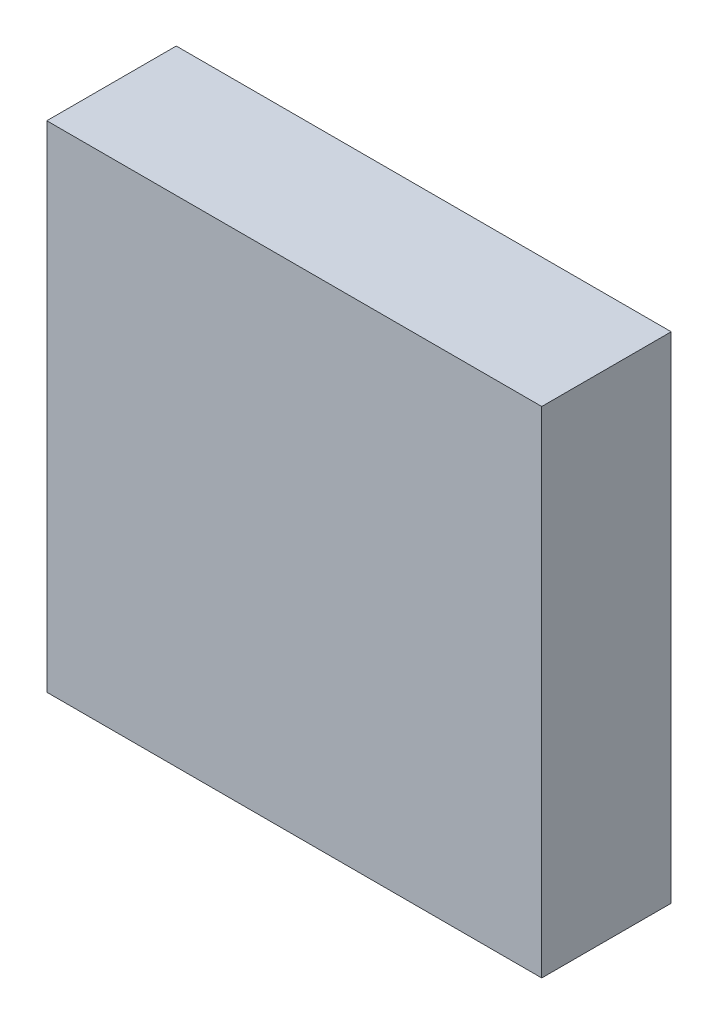
from build123d import *

# Parameters (mm, degrees)
SKETCH_1_W              = 6.5
SKETCH_1_H              = 6.5
COMPONENT_OUTLINE_DEPTH = 1.7


with BuildPart() as part:
    # 草图1 → Component_Outline (new body)
    with BuildSketch(Plane.XY):
        Rectangle(SKETCH_1_W, SKETCH_1_H)
    extrude(amount=COMPONENT_OUTLINE_DEPTH)


solid = part.part
